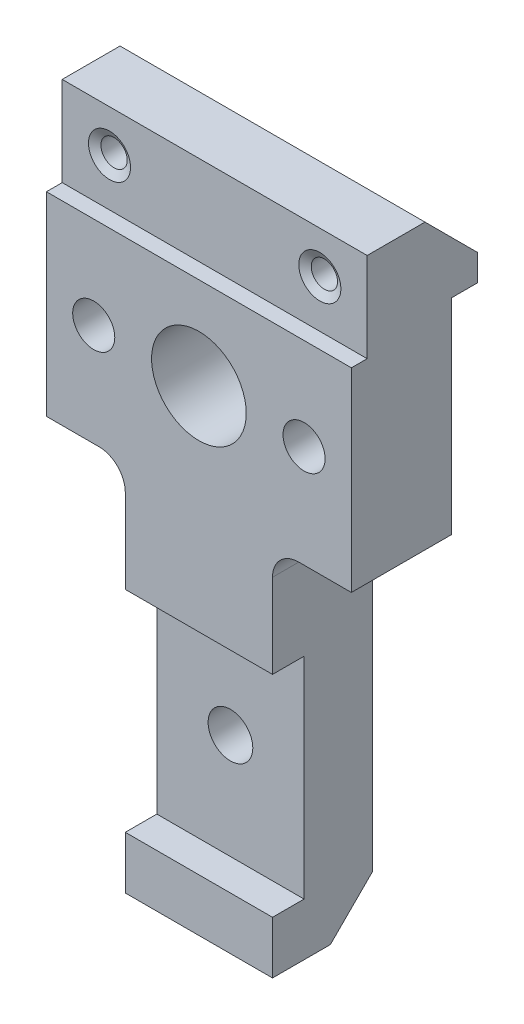
from build123d import *

# Parameters (mm, degrees)
BOSS_EXTRU_1_DEPTH         = 58
ESQUISSE2_R                = 4
ESQUISSE2_R_2              = 9
ENL_V_MAT_EXTRU_1_DEPTH    = 140.874944147
ESQUISSE3_R                = 11
ENL_V_MAT_EXTRU_2_DEPTH    = 3.5
R_P_TITION_LIN_AIRE1_COUNT = 2
R_P_TITION_LIN_AIRE1_PITCH = 40
TROU_TARAUD_M101_D         = 8.5


with BuildPart() as part:
    # Esquisse1 → Boss.-Extru.1 (new body)
    with BuildSketch(Plane(origin=(0, 0, 0), x_dir=(0, 0, -1), z_dir=(1, 0, 0))):
        Polygon((0, 0), (0, 10), (6, 10), (6, 50), (0, 50), (0, 108), (3, 108), (3, 125), (14, 125), (24, 115), (24, 110), (19, 110), (19, 8), (11, 0), align=None)
    extrude(amount=BOSS_EXTRU_1_DEPTH)

    # Esquisse2 → Enlèv. mat.-Extru.1 (cut, through all)
    with BuildSketch(Plane.XY):
        with Locations((49, 90.5)):
            Circle(ESQUISSE2_R)
        with Locations((9, 90.5)):
            Circle(ESQUISSE2_R)
        with Locations((29, 90.5)):
            Circle(ESQUISSE2_R_2)
        with BuildLine():
            Line((58, 0), (43, 0))
            Line((43, 0), (43, 66))
            ThreePointArc((43, 66), (44.464466094, 69.535533906), (48, 71))
            Line((48, 71), (58, 71))
            Line((58, 71), (58, 0))
        make_face()
        with BuildLine():
            Line((15, 0), (15, 66))
            ThreePointArc((15, 66), (13.535533906, 69.535533906), (10, 71))
            Line((10, 71), (0, 71))
            Line((0, 71), (0, 0))
            Line((0, 0), (15, 0))
        make_face()
    extrude(amount=-ENL_V_MAT_EXTRU_1_DEPTH, mode=Mode.SUBTRACT)

    # Esquisse3 → Enlèv. mat.-Extru.2 (cut)
    with BuildSketch(Plane(origin=(0, 0, -19), x_dir=(-1, 0, 0), z_dir=(0, 0, -1))):
        with Locations(Location((-29, 90.5, 0), (0, 0, 90))):
            Circle(ESQUISSE3_R)
    extrude(amount=-ENL_V_MAT_EXTRU_2_DEPTH, mode=Mode.SUBTRACT)

    # Esquisse5 → Trou taraudé M61 (revolve, cut)
    with BuildSketch(Plane(origin=(49, 117, -3), x_dir=(0, -1, 0), z_dir=(1, 0, 0))):
        Polygon((0, 0), (0, 16.502151548), (2.5, 15), (2.5, 0.866025404), (4, 0), align=None)
    trou_taraud_m61 = revolve(axis=Axis((49, 117, 3.35), (0, 0, -1)), mode=Mode.SUBTRACT)

    # Répétition linéaire1: Trou taraudé M61 ×2
    with Locations(*[(-i * R_P_TITION_LIN_AIRE1_PITCH, 0, 0) for i in range(1, R_P_TITION_LIN_AIRE1_COUNT)]):
        add(trou_taraud_m61, mode=Mode.SUBTRACT)

    # Trou taraudé M101 (through all)
    with Locations(Plane.XY.offset(-6)):
        with Locations((29, 30)):
            Hole(TROU_TARAUD_M101_D / 2)


solid = part.part
